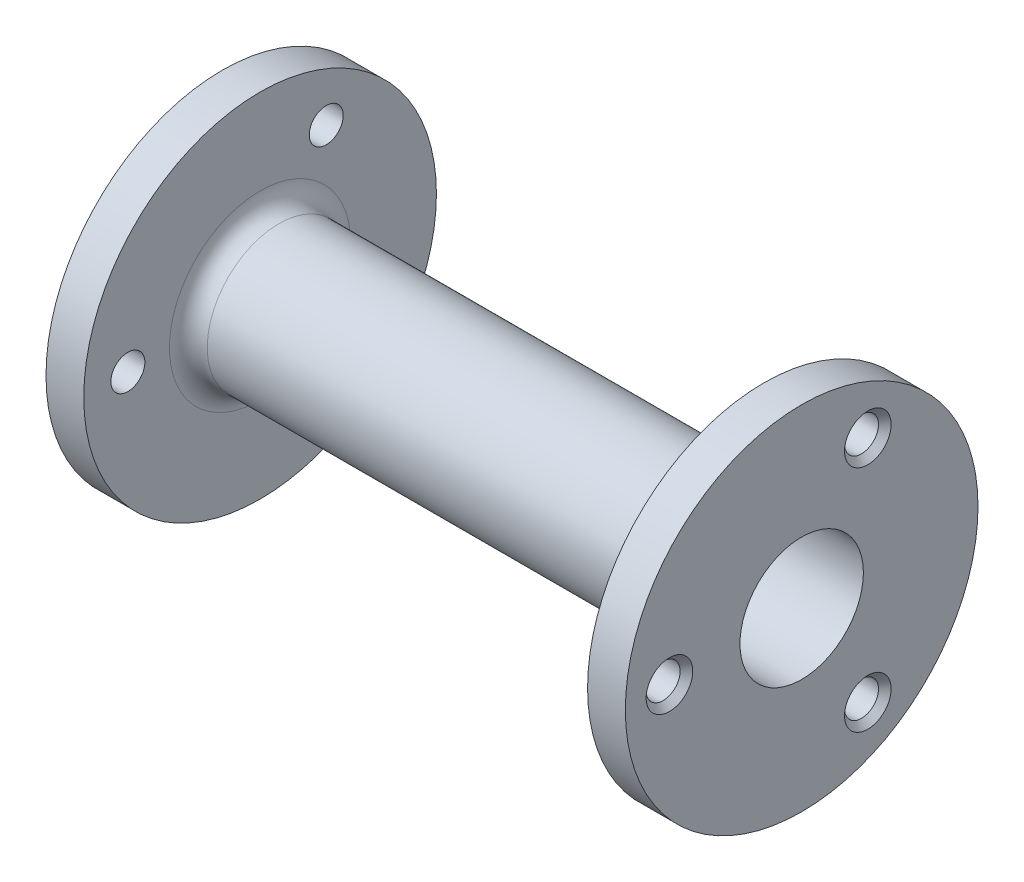
from build123d import *

# Parameters (mm, degrees)
SKETCH3_R          = 1.35
CUT_EXTRUDE1_DEPTH = 51.079936102
CHAMFER1_SIZE      = 0.5


with BuildPart() as part:
    # Sketch1 → Revolve1 (revolve)
    with BuildSketch(Plane.XY, mode=Mode.PRIVATE) as revolve1_sk:
        with BuildLine():
            Line((0, 4.9), (0, 14))
            Line((0, 14), (3, 14))
            Line((3, 14), (3, 7.2))
            ThreePointArc((3, 7.2), (3.439339828, 6.139339828), (4.5, 5.7))
            Line((4.5, 5.7), (41.5, 5.7))
            ThreePointArc((41.5, 5.7), (42.560660172, 6.139339828), (43, 7.2))
            Line((43, 7.2), (43, 14))
            Line((43, 14), (46, 14))
            Line((46, 14), (46, 4.9))
            Line((46, 4.9), (43, 4.9))
            Line((43, 4.9), (3, 4.9))
            Line((3, 4.9), (0, 4.9))
        make_face()
    revolve(revolve1_sk.sketch.rotate(Axis((0, 0, 0), (-1, 0, 0)), 90), axis=Axis((0, 0, 0), (-1, 0, 0)))

    # Sketch3 → Cut-Extrude1 (cut, through all)
    with BuildSketch(Plane(origin=(46, 0, 0), x_dir=(0, 0, -1), z_dir=(1, 0, 0))):
        with Locations((-10.5, 0)):
            Circle(SKETCH3_R)
        with Locations((5.25, 9.09326674)):
            Circle(SKETCH3_R)
        with Locations((5.25, -9.09326674)):
            Circle(SKETCH3_R)
    extrude(amount=-CUT_EXTRUDE1_DEPTH, mode=Mode.SUBTRACT)

    # Chamfer1
    chamfer1_edges = [part.edges().sort_by_distance(p)[0] for p in [
        (0, 0, 11.85),
        (46, 0, 11.85),
        (0, 9.09326674, -3.9),
        (46, 9.09326674, -3.9),
        (0, -9.09326674, -3.9),
        (46, -9.09326674, -3.9),
    ]]
    chamfer(chamfer1_edges, length=CHAMFER1_SIZE)


solid = part.part
